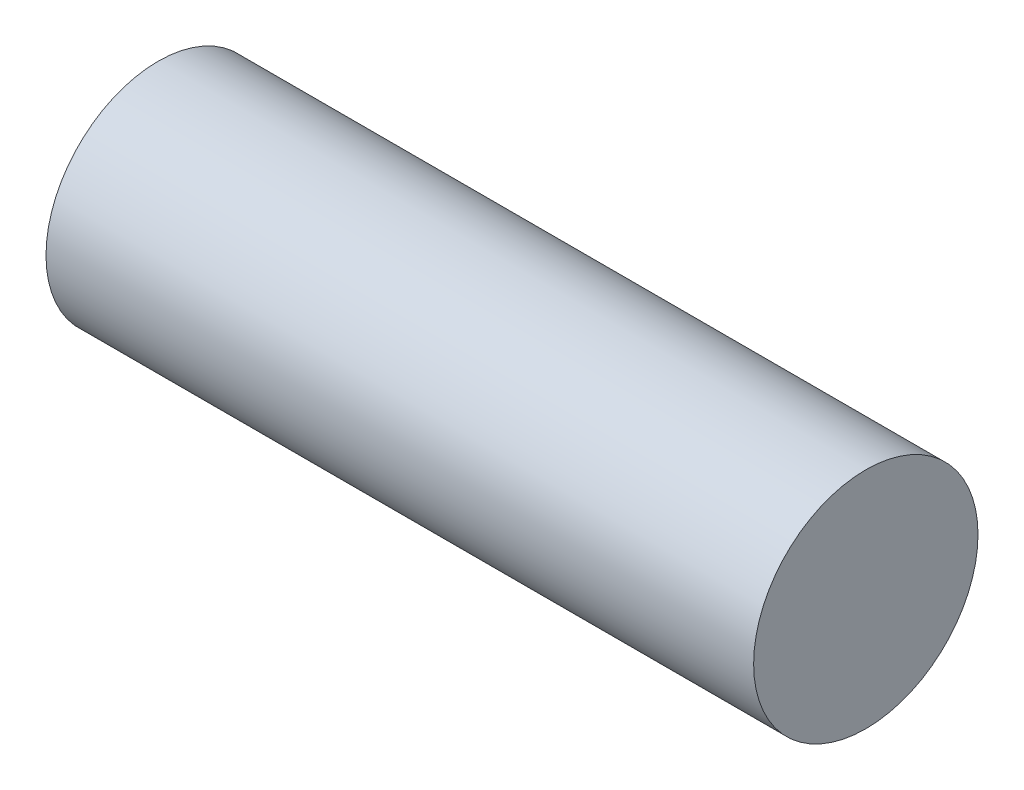
from build123d import *

# Parameters (mm, degrees)
SKETCH1_R  = 6.5
BASE_DEPTH = 20.5


with BuildPart() as part:
    # Sketch1 → Base (new, symmetric)
    with BuildSketch(Plane(origin=(0, 0, 0), x_dir=(0, 0, -1), z_dir=(1, 0, 0))):
        Circle(SKETCH1_R)
    extrude(amount=BASE_DEPTH, both=True)


solid = part.part
